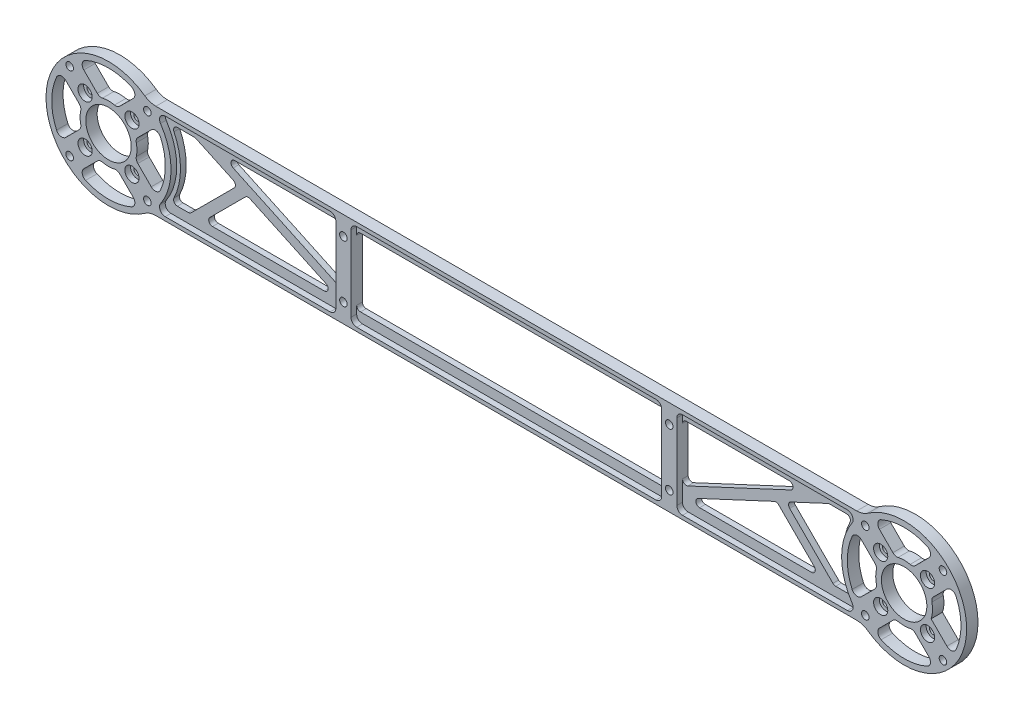
from build123d import *

# Parameters (mm, degrees)
SKETCH_1_R          = 2
SKETCH_1_R_2        = 12
SKETCH_1_W          = 164
SKETCH_1_H          = 36
EXTRUDE_1_DEPTH     = 6
SKETCH_2_R          = 2
CUT_EXTRUDE_1_DEPTH = 455.240024657
EXTRUDE_3_DEPTH     = 6
FILLET_3_R          = 2
CUT_EXTRUDE_START   = -3
SKETCH_6_W          = 164
SKETCH_6_H          = 46
CUT_EXTRUDE_3_DEPTH = 3
CUT_EXTRUDE_4_DEPTH = 455.240024657
FILLET_5_R          = 3
FILLET_7_R          = 3
SKETCH_9_R          = 3.75
CUT_EXTRUDE_5_DEPTH = 3
FILLET_8_R          = 10


with BuildPart() as part:
    # 草图1 → 凸台-拉伸1 (new body)
    with BuildSketch(Plane.XY):
        with BuildLine():
            Line((21.540659229, 25), (398.459340771, 25))
            ThreePointArc((398.459340771, 25), (453, 0), (398.459340771, -25))
            Line((398.459340771, -25), (21.540659229, -25))
            ThreePointArc((21.540659229, -25), (-33, 0), (21.540659229, 25))
        make_face()
        with Locations((-20.506096654, 20.506096654)):
            Circle(SKETCH_1_R, mode=Mode.SUBTRACT)
        with Locations((20.506096654, 20.506096654)):
            Circle(SKETCH_1_R, mode=Mode.SUBTRACT)
        with Locations((20.506096654, -20.506096654)):
            Circle(SKETCH_1_R, mode=Mode.SUBTRACT)
        with Locations((-20.506096654, -20.506096654)):
            Circle(SKETCH_1_R, mode=Mode.SUBTRACT)
        Circle(SKETCH_1_R_2, mode=Mode.SUBTRACT)
        with Locations((440.506096654, 20.506096654)):
            Circle(SKETCH_1_R, mode=Mode.SUBTRACT)
        with Locations((420, 0)):
            Circle(SKETCH_1_R_2, mode=Mode.SUBTRACT)
        with Locations((440.506096654, -20.506096654)):
            Circle(SKETCH_1_R, mode=Mode.SUBTRACT)
        with Locations((399.493903346, -20.506096654)):
            Circle(SKETCH_1_R, mode=Mode.SUBTRACT)
        with Locations((399.493903346, 20.506096654)):
            Circle(SKETCH_1_R, mode=Mode.SUBTRACT)
        with Locations((-12.374368671, 12.374368671)):
            Circle(SKETCH_1_R, mode=Mode.SUBTRACT)
        with Locations((12.374368671, 12.374368671)):
            Circle(SKETCH_1_R, mode=Mode.SUBTRACT)
        with Locations((12.374368671, -12.374368671)):
            Circle(SKETCH_1_R, mode=Mode.SUBTRACT)
        with Locations((-12.374368671, -12.374368671)):
            Circle(SKETCH_1_R, mode=Mode.SUBTRACT)
        with Locations((407.625631329, 12.374368671)):
            Circle(SKETCH_1_R, mode=Mode.SUBTRACT)
        with Locations((432.374368671, 12.374368671)):
            Circle(SKETCH_1_R, mode=Mode.SUBTRACT)
        with Locations((407.625631329, -12.374368671)):
            Circle(SKETCH_1_R, mode=Mode.SUBTRACT)
        with Locations((432.374368671, -12.374368671)):
            Circle(SKETCH_1_R, mode=Mode.SUBTRACT)
        with BuildLine():
            Line((30.01666204, 18), (120, 18))
            Line((120, 18), (120, -18))
            Line((120, -18), (30.01666204, -18))
            ThreePointArc((30.01666204, -18), (35, 0), (30.01666204, 18))
        make_face(mode=Mode.SUBTRACT)
        with BuildLine():
            Line((300, 18), (389.98333796, 18))
            ThreePointArc((389.98333796, 18), (385, 0), (389.98333796, -18))
            Line((389.98333796, -18), (300, -18))
            Line((300, -18), (300, 18))
        make_face(mode=Mode.SUBTRACT)
        with Locations((210, 0)):
            Rectangle(SKETCH_1_W, SKETCH_1_H, mode=Mode.SUBTRACT)
    extrude(amount=EXTRUDE_1_DEPTH)

    # 草图2 → 切除-拉伸1 (cut, through all)
    with BuildSketch(Plane.XY.offset(6)):
        with Locations((124, 15)):
            Circle(SKETCH_2_R)
        with Locations((124, -15)):
            Circle(SKETCH_2_R)
        with Locations((296, 15)):
            Circle(SKETCH_2_R)
        with Locations((296, -15)):
            Circle(SKETCH_2_R)
    extrude(amount=-CUT_EXTRUDE_1_DEPTH, mode=Mode.SUBTRACT)

    # 草图5 → 凸台-拉伸3 (add)
    with BuildSketch(Plane.XY.offset(6)):
        Polygon((54.628758777, 18), (120, -12.483110405), (120, -18), (70.263553639, 5.192485827), (47.071067812, -18), (40, -18), (65.441190629, 7.441190629), (42.797750862, 18), align=None)
    extrude_3 = extrude(amount=-EXTRUDE_3_DEPTH)

    # 镜向1: 凸台-拉伸3 across plane
    add(extrude_3.mirror(Plane.ZY.offset(-210)))

    # 圆角3
    fillet_3_edges = [part.edges().sort_by_distance(p)[0] for p in [
        (42.797750862, 18, 3),
        (54.628758777, 18, 3),
        (120, -12.483110405, 3),
        (70.263553639, 5.192485827, 3),
        (47.071067812, -18, 3),
        (40, -18, 3),
        (65.441190629, 7.441190629, 3),
        (300, -12.483110405, 3),
        (349.736446361, 5.192485827, 3),
        (372.928932188, -18, 3),
        (380, -18, 3),
        (354.558809371, 7.441190629, 3),
        (365.371241223, 18, 3),
        (120, -18, 3),
        (120, 18, 3),
        (30.01666204, 18, 3),
        (30.01666204, -18, 3),
        (389.98333796, -18, 3),
        (389.98333796, 18, 3),
        (300, 18, 3),
        (300, -18, 3),
        (292, -18, 3),
        (292, 18, 3),
        (128, 18, 3),
        (128, -18, 3),
    ]]
    fillet(fillet_3_edges, radius=FILLET_3_R)

    # 草图6 → 切除-拉伸3 (cut)
    with BuildSketch(Plane.XY.offset(6).offset(CUT_EXTRUDE_START)):
        with BuildLine():
            Line((120, 23), (120, -23))
            Line((120, -23), (23.664319132, -23))
            ThreePointArc((23.664319132, -23), (33, 0), (23.664319132, 23))
            Line((23.664319132, 23), (120, 23))
        make_face()
        with Locations((210, 0)):
            Rectangle(SKETCH_6_W, SKETCH_6_H)
        with BuildLine():
            Line((396.335680868, 23), (300, 23))
            Line((300, 23), (300, -23))
            Line((300, -23), (396.335680868, -23))
            ThreePointArc((396.335680868, -23), (387, 0), (396.335680868, 23))
        make_face()
    extrude(amount=CUT_EXTRUDE_3_DEPTH, mode=Mode.SUBTRACT)

    # 草图7 → 切除-拉伸4 (cut, through all)
    with BuildSketch(Plane.XY.offset(6)):
        with BuildLine():
            Line((-15.896299896, 25.442241442), (-4.699027432, 14.244968978))
            ThreePointArc((-4.699027432, 14.244968978), (0, 15), (4.699027432, 14.244968978))
            Line((4.699027432, 14.244968978), (15.896299896, 25.442241442))
            ThreePointArc((15.896299896, 25.442241442), (0, 30), (-15.896299896, 25.442241442))
        make_face()
        with BuildLine():
            Line((25.442241442, 15.896299896), (14.244968978, 4.699027432))
            ThreePointArc((14.244968978, 4.699027432), (15, 0), (14.244968978, -4.699027432))
            Line((14.244968978, -4.699027432), (25.442241442, -15.896299896))
            ThreePointArc((25.442241442, -15.896299896), (30, 0), (25.442241442, 15.896299896))
        make_face()
        with BuildLine():
            Line((15.896299896, -25.442241442), (4.699027432, -14.244968978))
            ThreePointArc((4.699027432, -14.244968978), (0, -15), (-4.699027432, -14.244968978))
            Line((-4.699027432, -14.244968978), (-15.896299896, -25.442241442))
            ThreePointArc((-15.896299896, -25.442241442), (0, -30), (15.896299896, -25.442241442))
        make_face()
        with BuildLine():
            Line((-25.442241442, -15.896299896), (-14.244968978, -4.699027432))
            ThreePointArc((-14.244968978, -4.699027432), (-15, 0), (-14.244968978, 4.699027432))
            Line((-14.244968978, 4.699027432), (-25.442241442, 15.896299896))
            ThreePointArc((-25.442241442, 15.896299896), (-30, 0), (-25.442241442, -15.896299896))
        make_face()
        with BuildLine():
            Line((445.442241442, 15.896299896), (434.244968978, 4.699027432))
            ThreePointArc((434.244968978, 4.699027432), (435, 0), (434.244968978, -4.699027432))
            Line((434.244968978, -4.699027432), (445.442241442, -15.896299896))
            ThreePointArc((445.442241442, -15.896299896), (450, 0), (445.442241442, 15.896299896))
        make_face()
        with BuildLine():
            Line((435.896299896, -25.442241442), (424.699027432, -14.244968978))
            ThreePointArc((424.699027432, -14.244968978), (420, -15), (415.300972568, -14.244968978))
            Line((415.300972568, -14.244968978), (404.103700104, -25.442241442))
            ThreePointArc((404.103700104, -25.442241442), (420, -30), (435.896299896, -25.442241442))
        make_face()
        with BuildLine():
            Line((394.557758558, -15.896299896), (405.755031022, -4.699027432))
            ThreePointArc((405.755031022, -4.699027432), (405, 0), (405.755031022, 4.699027432))
            Line((405.755031022, 4.699027432), (394.557758558, 15.896299896))
            ThreePointArc((394.557758558, 15.896299896), (390, 0), (394.557758558, -15.896299896))
        make_face()
        with BuildLine():
            Line((404.103700104, 25.442241442), (415.300972568, 14.244968978))
            ThreePointArc((415.300972568, 14.244968978), (420, 15), (424.699027432, 14.244968978))
            Line((424.699027432, 14.244968978), (435.896299896, 25.442241442))
            ThreePointArc((435.896299896, 25.442241442), (420, 30), (404.103700104, 25.442241442))
        make_face()
    extrude(amount=-CUT_EXTRUDE_4_DEPTH, mode=Mode.SUBTRACT)

    # 圆角5
    fillet_5_edges = [part.edges().sort_by_distance(p)[0] for p in [
        (120, 23, 4.5),
        (23.664319132, 23, 4.5),
        (120, -23, 4.5),
        (23.664319132, -23, 4.5),
        (300, -23, 4.5),
        (396.335680868, 23, 4.5),
        (396.335680868, -23, 4.5),
        (300, 23, 4.5),
        (292, 23, 4.5),
        (128, -23, 4.5),
        (292, -23, 4.5),
        (128, 23, 4.5),
    ]]
    fillet(fillet_5_edges, radius=FILLET_5_R)

    # 圆角7
    fillet_7_edges = [part.edges().sort_by_distance(p)[0] for p in [
        (15.896299896, -25.442241442, 3),
        (-15.896299896, -25.442241442, 3),
        (-4.699027432, -14.244968978, 3),
        (4.699027432, -14.244968978, 3),
        (-25.442241442, -15.896299896, 3),
        (-25.442241442, 15.896299896, 3),
        (-14.244968978, 4.699027432, 3),
        (-14.244968978, -4.699027432, 3),
        (25.442241442, 15.896299896, 3),
        (25.442241442, -15.896299896, 3),
        (14.244968978, -4.699027432, 3),
        (14.244968978, 4.699027432, 3),
        (404.103700104, 25.442241442, 3),
        (435.896299896, 25.442241442, 3),
        (424.699027432, 14.244968978, 3),
        (415.300972568, 14.244968978, 3),
        (394.557758558, -15.896299896, 3),
        (394.557758558, 15.896299896, 3),
        (405.755031022, 4.699027432, 3),
        (405.755031022, -4.699027432, 3),
        (445.442241442, 15.896299896, 3),
        (445.442241442, -15.896299896, 3),
        (434.244968978, 4.699027432, 3),
        (435.896299896, -25.442241442, 3),
        (404.103700104, -25.442241442, 3),
        (415.300972568, -14.244968978, 3),
        (424.699027432, -14.244968978, 3),
        (-15.896299896, 25.442241442, 3),
        (15.896299896, 25.442241442, 3),
        (4.699027432, 14.244968978, 3),
        (-4.699027432, 14.244968978, 3),
    ]]
    fillet(fillet_7_edges, radius=FILLET_7_R)

    # 草图9 → 切除-拉伸5 (cut)
    with BuildSketch(Plane.XY.offset(6)):
        with Locations((-12.374368671, 12.374368671)):
            Circle(SKETCH_9_R)
        with Locations((12.374368671, 12.374368671)):
            Circle(SKETCH_9_R)
        with Locations((12.374368671, -12.374368671)):
            Circle(SKETCH_9_R)
        with Locations((-12.374368671, -12.374368671)):
            Circle(SKETCH_9_R)
        with Locations((407.625631329, 12.374368671)):
            Circle(SKETCH_9_R)
        with Locations((432.374368671, 12.374368671)):
            Circle(SKETCH_9_R)
        with Locations((432.374368671, -12.374368671)):
            Circle(SKETCH_9_R)
        with Locations((407.625631329, -12.374368671)):
            Circle(SKETCH_9_R)
    extrude(amount=-CUT_EXTRUDE_5_DEPTH, mode=Mode.SUBTRACT)

    # 圆角8
    fillet_8_edges = [part.edges().sort_by_distance(p)[0] for p in [
        (21.540659229, 25, 3),
        (398.459340771, 25, 3),
        (398.459340771, -25, 3),
        (21.540659229, -25, 3),
    ]]
    fillet(fillet_8_edges, radius=FILLET_8_R)


solid = part.part
